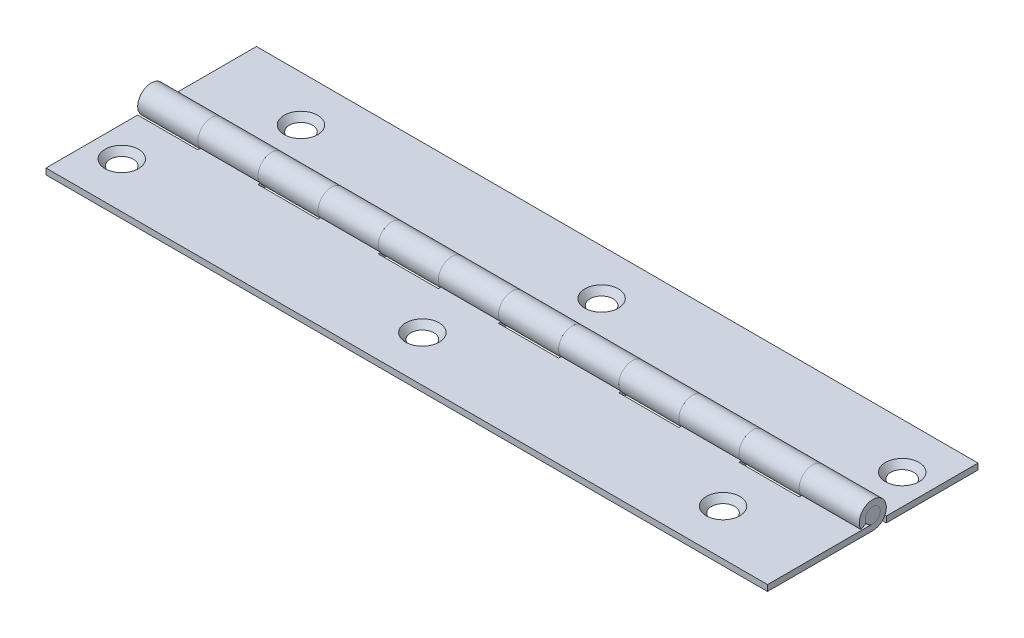
from build123d import *

# Parameters (mm, degrees)
LEFT_LEAF_DEPTH                               = 76.2
CUT_EXTRUDE1_DEPTH                            = 80.426418346
CUT_EXTRUDE1_DEPTH_BACK                       = 80.426418346
SKETCH2_W                                     = 12.7
SKETCH2_H                                     = 5.715
RIGHT_LEAF_DEPTH                              = 76.2
CUT_EXTRUDE2_DEPTH                            = 80.426418346
CUT_EXTRUDE2_DEPTH_BACK                       = 80.426418346
SKETCH9_W                                     = 12.7
SKETCH9_H                                     = 5.715
SKETCH10_R                                    = 1.5875
EXTRUDE1_DEPTH                                = 76.2
CSK_FOR_6_FLAT_HEAD_MACHINE_SCREW1_AT_2_COUNT = 2
CSK_FOR_6_FLAT_HEAD_MACHINE_SCREW1_AT_2_PITCH = 63.5
CSK_FOR_6_FLAT_HEAD_MACHINE_SCREW1_AT_3_COUNT = 2
CSK_FOR_6_FLAT_HEAD_MACHINE_SCREW1_AT_3_PITCH = 127
CSK_FOR_6_FLAT_HEAD_MACHINE_SCREW1_AT_4_COUNT = 2
CSK_FOR_6_FLAT_HEAD_MACHINE_SCREW1_AT_4_PITCH = 28.171107823
CSK_FOR_6_FLAT_HEAD_MACHINE_SCREW1_AT_5_COUNT = 2
CSK_FOR_6_FLAT_HEAD_MACHINE_SCREW1_AT_5_PITCH = 56.682989653
CSK_FOR_6_FLAT_HEAD_MACHINE_SCREW1_AT_6_COUNT = 2
CSK_FOR_6_FLAT_HEAD_MACHINE_SCREW1_AT_6_PITCH = 117.033376932


with BuildPart() as part:
    # Sketch1 → Left Leaf (new, symmetric)
    with BuildSketch(Plane(origin=(0, 0, 0), x_dir=(0, 0, -1), z_dir=(1, 0, 0))):
        with BuildLine():
            Line((0, -1.5875), (-22.225, -1.5875))
            Line((-22.225, -1.5875), (-22.225, -2.8575))
            Line((-22.225, -2.8575), (0, -2.8575))
            ThreePointArc((0, -2.8575), (1.449117488, 2.462796125), (-2.497904417, -1.387724676))
            Line((-2.497904417, -1.387724676), (-1.387724676, -0.770958153))
            ThreePointArc((-1.387724676, -0.770958153), (0.805065271, 1.36822007), (0, -1.5875))
        make_face()
    extrude(amount=LEFT_LEAF_DEPTH, both=True)

    # Sketch2 → Cut-Extrude1 (cut, two sides: drawn at the far end of the back side and taken through both)
    with BuildSketch(Plane(origin=(0, 0, 0), x_dir=(1, 0, 0), z_dir=(0, 1, 0)).offset(-CUT_EXTRUDE1_DEPTH_BACK)):
        with Locations((-44.45, 0)):
            Rectangle(SKETCH2_W, SKETCH2_H)
        with Locations((-69.85, 0)):
            Rectangle(SKETCH2_W, SKETCH2_H)
        with Locations((57.15, 0)):
            Rectangle(SKETCH2_W, SKETCH2_H)
        with Locations((-19.05, 0)):
            Rectangle(SKETCH2_W, SKETCH2_H)
        with Locations((6.35, 0)):
            Rectangle(SKETCH2_W, SKETCH2_H)
        with Locations((31.75, 0)):
            Rectangle(SKETCH2_W, SKETCH2_H)
    extrude(amount=CUT_EXTRUDE1_DEPTH + CUT_EXTRUDE1_DEPTH_BACK, mode=Mode.SUBTRACT)


with BuildPart() as body_2:
    # Sketch3 → Right Leaf (new, symmetric)
    with BuildSketch(Plane(origin=(0, 0, 0), x_dir=(0, 0, -1), z_dir=(1, 0, 0))):
        with BuildLine():
            Line((22.225, -1.5875), (22.225, -2.8575))
            Line((22.225, -2.8575), (0, -2.8575))
            ThreePointArc((0, -2.8575), (-1.449117488, 2.462796125), (2.497904417, -1.387724676))
            Line((2.497904417, -1.387724676), (1.387724676, -0.770958153))
            ThreePointArc((1.387724676, -0.770958153), (-0.805065271, 1.36822007), (0, -1.5875))
            Line((0, -1.5875), (22.225, -1.5875))
        make_face()
    extrude(amount=RIGHT_LEAF_DEPTH, both=True)

    # Sketch9 → Cut-Extrude2 (cut, two sides: drawn at the far end of the back side and taken through both)
    with BuildSketch(Plane(origin=(0, 0, 0), x_dir=(1, 0, 0), z_dir=(0, 1, 0)).offset(-CUT_EXTRUDE2_DEPTH_BACK)):
        with Locations((-57.15, 0)):
            Rectangle(SKETCH9_W, SKETCH9_H)
        with Locations((-31.75, 0)):
            Rectangle(SKETCH9_W, SKETCH9_H)
        with Locations((-6.35, 0)):
            Rectangle(SKETCH9_W, SKETCH9_H)
        with Locations((19.05, 0)):
            Rectangle(SKETCH9_W, SKETCH9_H)
        with Locations((44.45, 0)):
            Rectangle(SKETCH9_W, SKETCH9_H)
        with Locations((69.85, 0)):
            Rectangle(SKETCH9_W, SKETCH9_H)
    extrude(amount=CUT_EXTRUDE2_DEPTH + CUT_EXTRUDE2_DEPTH_BACK, mode=Mode.SUBTRACT)

    # Sketch12 → CSK for #6 Flat Head Machine Screw1 (revolve, cut)
    with BuildSketch(Plane(origin=(-57.15, -1.5875, -12.573), x_dir=(0, 0, 1), z_dir=(1, 0, 0))):
        Polygon((0, 0), (0, 1.27), (1.89865, 1.27), (1.89865, 1.891953401), (3.5433, 0), align=None)
    csk_for_6_flat_head_machine_screw1 = revolve(axis=Axis((-57.15, 4.7625, -12.573), (0, -1, 0)), mode=Mode.SUBTRACT)

    # CSK for #6 Flat Head Machine Screw1 at 2: CSK for #6 Flat Head Machine Screw1 ×2
    with Locations(*[(i * CSK_FOR_6_FLAT_HEAD_MACHINE_SCREW1_AT_2_PITCH, 0, 0) for i in range(1, CSK_FOR_6_FLAT_HEAD_MACHINE_SCREW1_AT_2_COUNT)]):
        add(csk_for_6_flat_head_machine_screw1, mode=Mode.SUBTRACT)

    # CSK for #6 Flat Head Machine Screw1 at 3: CSK for #6 Flat Head Machine Screw1 ×2
    with Locations(*[(i * CSK_FOR_6_FLAT_HEAD_MACHINE_SCREW1_AT_3_PITCH, 0, 0) for i in range(1, CSK_FOR_6_FLAT_HEAD_MACHINE_SCREW1_AT_3_COUNT)]):
        add(csk_for_6_flat_head_machine_screw1, mode=Mode.SUBTRACT)


with BuildPart() as body_3:
    # Sketch10 → Extrude1 (new, symmetric)
    with BuildSketch(Plane(origin=(0, 0, 0), x_dir=(0, 0, -1), z_dir=(1, 0, 0))):
        with Locations(Location((0, 0, 0), (0, 0, 180))):
            Circle(SKETCH10_R)
    extrude(amount=EXTRUDE1_DEPTH, both=True)


with BuildPart() as part_1:
    add(part.part)

    # CSK for #6 Flat Head Machine Screw1 at 4: CSK for #6 Flat Head Machine Screw1 ×2
    with Locations(*[Vector(-0.4508164918325266, 0, 0.8926166538284022) * (i * CSK_FOR_6_FLAT_HEAD_MACHINE_SCREW1_AT_4_PITCH) for i in range(1, CSK_FOR_6_FLAT_HEAD_MACHINE_SCREW1_AT_4_COUNT)]):
        add(csk_for_6_flat_head_machine_screw1, mode=Mode.SUBTRACT)

    # CSK for #6 Flat Head Machine Screw1 at 5: CSK for #6 Flat Head Machine Screw1 ×2
    with Locations(*[Vector(0.8962124318248272, 0, 0.44362515375328926) * (i * CSK_FOR_6_FLAT_HEAD_MACHINE_SCREW1_AT_5_PITCH) for i in range(1, CSK_FOR_6_FLAT_HEAD_MACHINE_SCREW1_AT_5_COUNT)]):
        add(csk_for_6_flat_head_machine_screw1, mode=Mode.SUBTRACT)

    # CSK for #6 Flat Head Machine Screw1 at 6: CSK for #6 Flat Head Machine Screw1 ×2
    with Locations(*[Vector(0.97664446670509, 0, 0.2148617826751197) * (i * CSK_FOR_6_FLAT_HEAD_MACHINE_SCREW1_AT_6_PITCH) for i in range(1, CSK_FOR_6_FLAT_HEAD_MACHINE_SCREW1_AT_6_COUNT)]):
        add(csk_for_6_flat_head_machine_screw1, mode=Mode.SUBTRACT)


solid = Compound([body_2.part, body_3.part, part_1.part])
